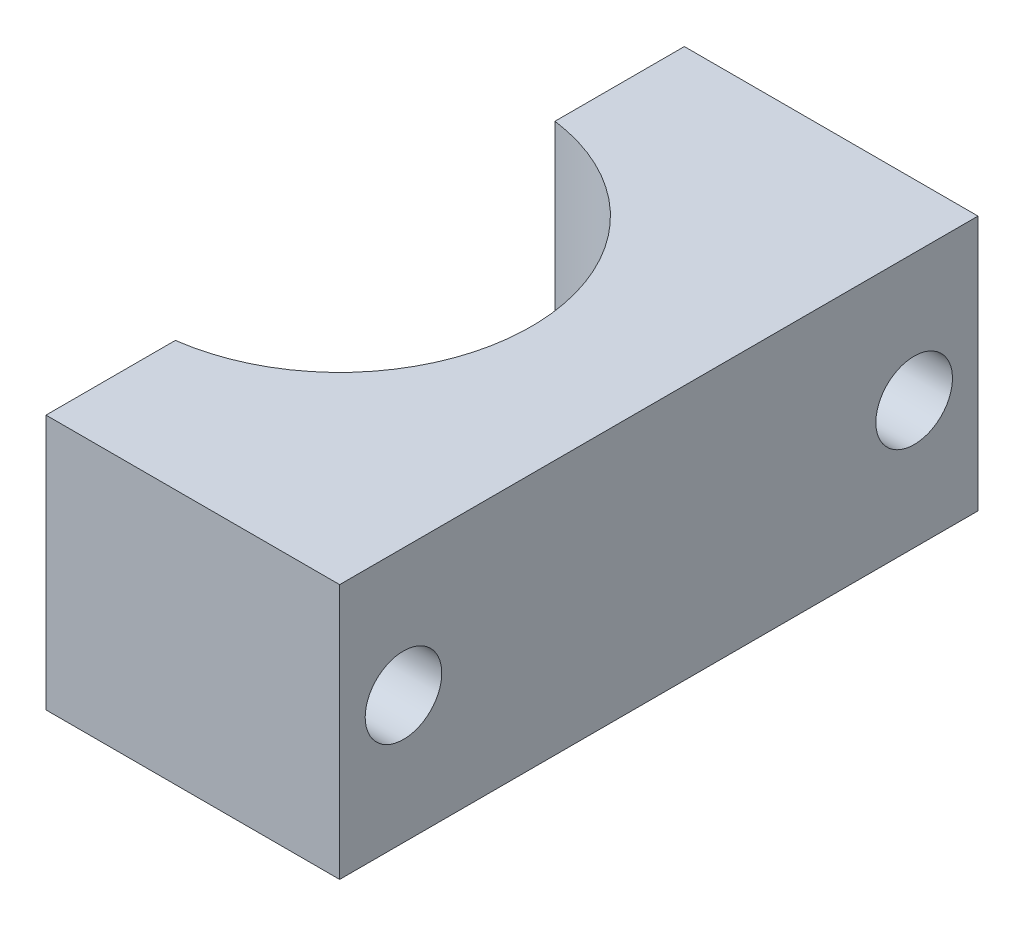
from build123d import *

# Parameters (mm, degrees)
SKETCH1_W           = 25
SKETCH1_H           = 25
BOSS_EXTRUDE1_DEPTH = 10
SKETCH2_R           = 7.5
CUT_EXTRUDE1_DEPTH  = 21.310096012
SKETCH3_W           = 12.5
SKETCH3_H           = 25
CUT_EXTRUDE2_DEPTH  = 10
SKETCH4_R           = 1.5
CUT_EXTRUDE3_DEPTH  = 21.310096012
CUT_EXTRUDE4_DEPTH  = 21.310096012


with BuildPart() as part:
    # Sketch1 → Boss-Extrude1 (new body)
    with BuildSketch(Plane(origin=(0, 0, 0), x_dir=(1, 0, 0), z_dir=(0, 1, 0))):
        Rectangle(SKETCH1_W, SKETCH1_H)
    extrude(amount=BOSS_EXTRUDE1_DEPTH)

    # Sketch2 → Cut-Extrude1 (cut, through all)
    with BuildSketch(Plane(origin=(0, 10, 0), x_dir=(1, 0, 0), z_dir=(0, 1, 0))):
        with Locations(Location((0, 0, 0), (0, 0, 270))):
            Circle(SKETCH2_R)
    extrude(amount=-CUT_EXTRUDE1_DEPTH, mode=Mode.SUBTRACT)

    # Sketch3 → Cut-Extrude2 (cut)
    with BuildSketch(Plane(origin=(0, 10, 0), x_dir=(1, 0, 0), z_dir=(0, 1, 0))):
        with Locations((-6.25, 0)):
            Rectangle(SKETCH3_W, SKETCH3_H)
    extrude(amount=-CUT_EXTRUDE2_DEPTH, mode=Mode.SUBTRACT)

    # Sketch4 → Cut-Extrude3 (cut, through all)
    with BuildSketch(Plane.ZY):
        with Locations((-10, 5)):
            Circle(SKETCH4_R)
        with Locations((10, 5)):
            Circle(SKETCH4_R)
    extrude(amount=-CUT_EXTRUDE3_DEPTH, mode=Mode.SUBTRACT)

    # Sketch5 → Cut-Extrude4 (cut, through all)
    with BuildSketch(Plane(origin=(0, 10, 0), x_dir=(1, 0, 0), z_dir=(0, 1, 0))):
        with BuildLine():
            Line((1, 12.5), (0, 12.5))
            Line((0, 12.5), (0, 7.5))
            ThreePointArc((0, 7.5), (0.501119845, 7.483239867), (1, 7.433034374))
            Line((1, 7.433034374), (1, 12.5))
        make_face()
        with BuildLine():
            ThreePointArc((1, -7.433034374), (0.501119845, -7.483239867), (0, -7.5))
            Line((0, -7.5), (0, -12.5))
            Line((0, -12.5), (1, -12.5))
            Line((1, -12.5), (1, -7.433034374))
        make_face()
        with BuildLine():
            ThreePointArc((1, 7.433034374), (0.501119845, 7.483239867), (0, 7.5))
            Line((0, 7.5), (0, -7.5))
            ThreePointArc((0, -7.5), (0.501119845, -7.483239867), (1, -7.433034374))
            Line((1, -7.433034374), (1, 7.433034374))
        make_face()
    extrude(amount=-CUT_EXTRUDE4_DEPTH, mode=Mode.SUBTRACT)


solid = part.part
